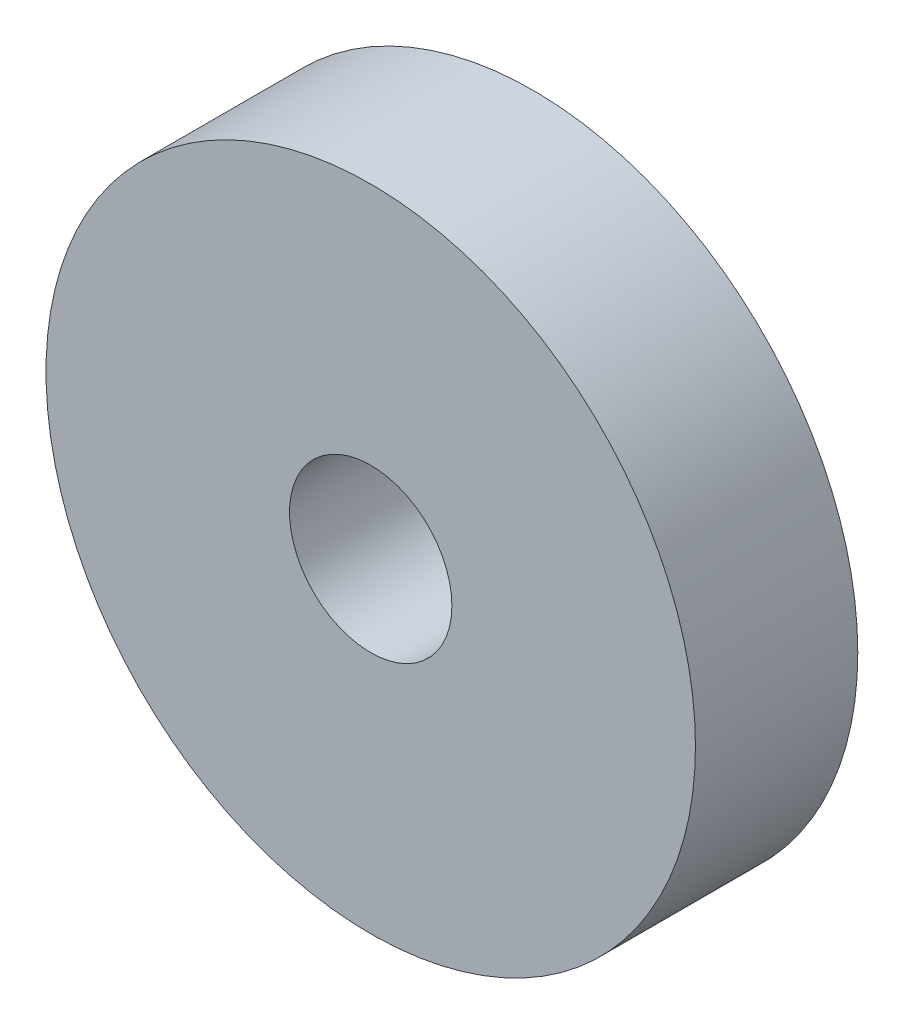
from build123d import *

# Parameters (mm, degrees)
SKETCH1_R           = 12.7
SKETCH1_R_2         = 3.175
BOSS_EXTRUDE1_DEPTH = 6.35


with BuildPart() as part:
    # Sketch1 → Boss-Extrude1 (new body)
    with BuildSketch(Plane.XY):
        Circle(SKETCH1_R)
        Circle(SKETCH1_R_2, mode=Mode.SUBTRACT)
    extrude(amount=BOSS_EXTRUDE1_DEPTH)


solid = part.part
